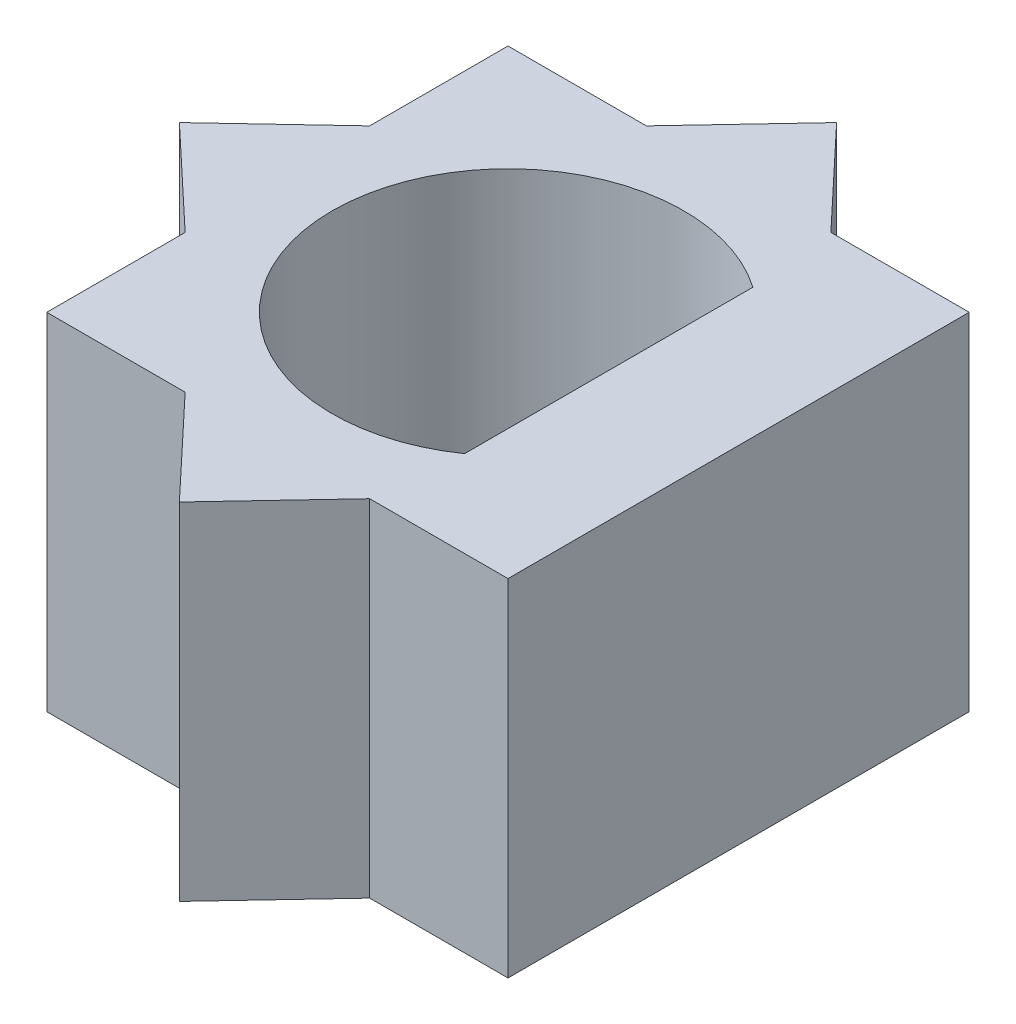
from build123d import *

# Parameters (mm, degrees)
ESQUISSE1_W        = 8
ESQUISSE1_H        = 8
ESQUISSE1_R        = 3.05
BOSS_EXTRU_1_DEPTH = 6


with BuildPart() as part:
    # Esquisse1 → Boss.-Extru.1 (new body)
    # profile 1 of 6: a face of its own
    with BuildSketch(Plane(origin=(0, 0, 0), x_dir=(1, 0, 0), z_dir=(0, 1, 0))):
        Rectangle(ESQUISSE1_W, ESQUISSE1_H)
        Circle(ESQUISSE1_R, mode=Mode.SUBTRACT)
    # profile 2 of 6: a face of its own
    with BuildSketch(Plane(origin=(0, 0, 0), x_dir=(1, 0, 0), z_dir=(0, 1, 0))):
        Polygon((1.6, -4), (-1.6, -4), (0, -5.7), align=None)
    # profile 3 of 6: a face of its own
    with BuildSketch(Plane(origin=(0, 0, 0), x_dir=(1, 0, 0), z_dir=(0, 1, 0))):
        Polygon((-1.6, 4), (-4, 4), (-4, 1.6), (-4, -1.6), (-4, -4), (-1.6, -4), (1.6, -4), (4, -4), (4, 4), (1.6, 4), align=None)
        with BuildLine():
            ThreePointArc((1.747140521, -2.5), (-3.05, 0), (1.747140521, 2.5))
            ThreePointArc((1.747140521, 2.5), (2.70474385, 1.409560465), (3.05, 0))
            ThreePointArc((3.05, 0), (2.70474385, -1.409560465), (1.747140521, -2.5))
        make_face(mode=Mode.SUBTRACT)
    # profile 4 of 6: a face of its own
    with BuildSketch(Plane(origin=(0, 0, 0), x_dir=(1, 0, 0), z_dir=(0, 1, 0))):
        with BuildLine():
            ThreePointArc((3.05, 0), (2.70474385, 1.409560465), (1.747140521, 2.5))
            Line((1.747140521, 2.5), (1.747140521, -2.5))
            ThreePointArc((1.747140521, -2.5), (2.70474385, -1.409560465), (3.05, 0))
        make_face()
    # profile 5 of 6: a face of its own
    with BuildSketch(Plane(origin=(0, 0, 0), x_dir=(1, 0, 0), z_dir=(0, 1, 0))):
        Polygon((-4, -1.6), (-4, 1.6), (-5.7, 0), align=None)
    # profile 6 of 6: a face of its own
    with BuildSketch(Plane(origin=(0, 0, 0), x_dir=(1, 0, 0), z_dir=(0, 1, 0))):
        Polygon((0, 5.7), (-1.6, 4), (1.6, 4), align=None)
    extrude(amount=BOSS_EXTRU_1_DEPTH)


solid = part.part
